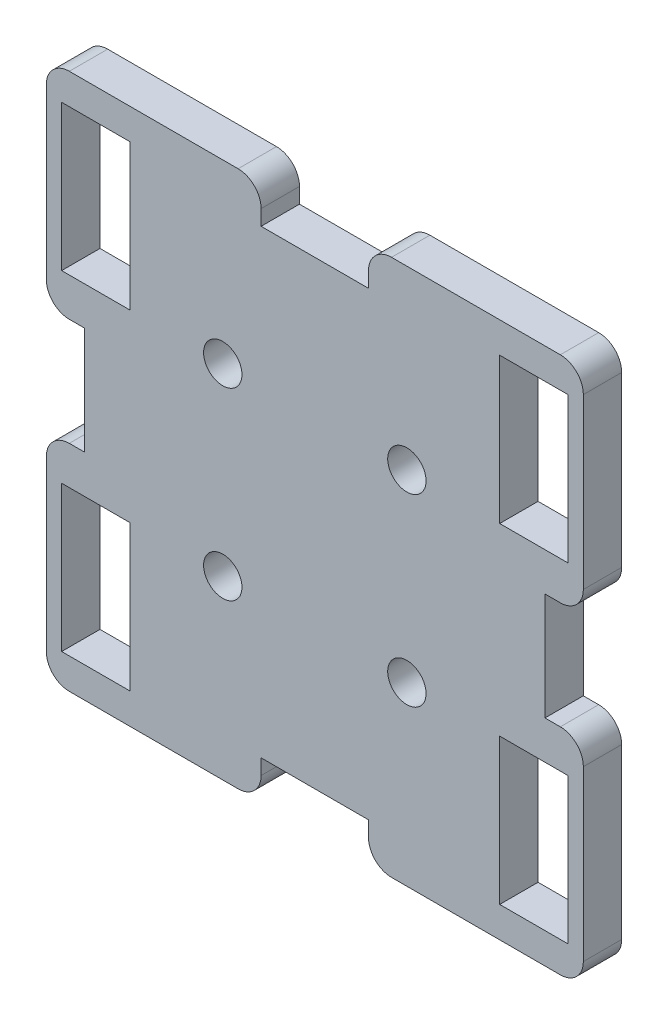
from build123d import *

# Parameters (mm, degrees)
SKETCH_1_R      = 2.5
SKETCH_1_W      = 8.9
SKETCH_1_H      = 19
EXTRUDE_1_DEPTH = 5


with BuildPart() as part:
    # 草图1 → 凸台-拉伸1 (new body)
    with BuildSketch(Plane.XY):
        with BuildLine():
            Line((3, 0), (25, 0))
            ThreePointArc((25, 0), (27.121320344, 0.878679656), (28, 3))
            Line((28, 3), (28, 5))
            Line((28, 5), (42, 5))
            Line((42, 5), (42, 3))
            ThreePointArc((42, 3), (42.878679656, 0.878679656), (45, 0))
            Line((45, 0), (67, 0))
            ThreePointArc((67, 0), (69.121320344, 0.878679656), (70, 3))
            Line((70, 3), (70, 25))
            ThreePointArc((70, 25), (69.121320344, 27.121320344), (67, 28))
            Line((67, 28), (65, 28))
            Line((65, 28), (65, 42))
            Line((65, 42), (67, 42))
            ThreePointArc((67, 42), (69.121320344, 42.878679656), (70, 45))
            Line((70, 45), (70, 67))
            ThreePointArc((70, 67), (69.121320344, 69.121320344), (67, 70))
            Line((67, 70), (45, 70))
            ThreePointArc((45, 70), (42.878679656, 69.121320344), (42, 67))
            Line((42, 67), (42, 65))
            Line((42, 65), (28, 65))
            Line((28, 65), (28, 67))
            ThreePointArc((28, 67), (27.121320344, 69.121320344), (25, 70))
            Line((25, 70), (3, 70))
            ThreePointArc((3, 70), (0.878679656, 69.121320344), (0, 67))
            Line((0, 67), (0, 45))
            ThreePointArc((0, 45), (0.878679656, 42.878679656), (3, 42))
            Line((3, 42), (5, 42))
            Line((5, 42), (5, 28))
            Line((5, 28), (3, 28))
            ThreePointArc((3, 28), (0.878679656, 27.121320344), (0, 25))
            Line((0, 25), (0, 3))
            ThreePointArc((0, 3), (0.878679656, 0.878679656), (3, 0))
        make_face()
        with Locations((23, 47)):
            Circle(SKETCH_1_R, mode=Mode.SUBTRACT)
        with Locations((47, 47)):
            Circle(SKETCH_1_R, mode=Mode.SUBTRACT)
        with Locations((23, 23)):
            Circle(SKETCH_1_R, mode=Mode.SUBTRACT)
        with Locations((47, 23)):
            Circle(SKETCH_1_R, mode=Mode.SUBTRACT)
        with Locations((63.55, 56.5)):
            Rectangle(SKETCH_1_W, SKETCH_1_H, mode=Mode.SUBTRACT)
        with Locations((63.55, 13.5)):
            Rectangle(SKETCH_1_W, SKETCH_1_H, mode=Mode.SUBTRACT)
        with Locations((6.45, 56.5)):
            Rectangle(SKETCH_1_W, SKETCH_1_H, mode=Mode.SUBTRACT)
        with Locations((6.45, 13.5)):
            Rectangle(SKETCH_1_W, SKETCH_1_H, mode=Mode.SUBTRACT)
    extrude(amount=EXTRUDE_1_DEPTH)


solid = part.part
